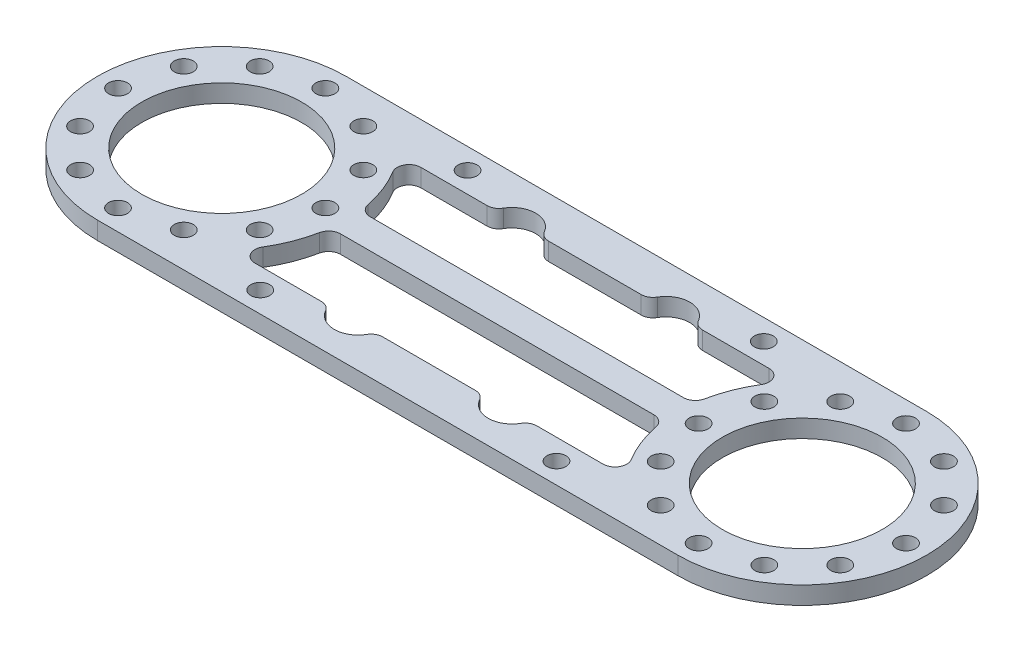
from build123d import *

# Parameters (mm, degrees)
SKETCH_1_R          = 13.5
SKETCH_1_R_2        = 1.6
EXTRUDE_1_DEPTH     = 3
CUT_EXTRUDE_START   = -10
CUT_EXTRUDE_1_DEPTH = 10
SKETCH_3_W          = 59.8
SKETCH_3_H          = 5
EXTRUDE_1_2_DEPTH   = 3
FILLET_1_R          = 2
SKETCH_4_R          = 1.6
CUT_EXTRUDE_2_DEPTH = 10


with BuildPart() as part:
    # 草图1 → Extrude 1 (new body)
    with BuildSketch(Plane(origin=(0, 0, 0), x_dir=(1, 0, 0), z_dir=(0, 1, 0))):
        with BuildLine():
            Line((-49, -44), (49, -44))
            ThreePointArc((49, -44), (70, -65), (49, -86))
            Line((49, -86), (-49, -86))
            ThreePointArc((-49, -86), (-70, -65), (-49, -44))
        make_face()
        with Locations(Location((-49, -65, 0), (0, 0, 270))):
            Circle(SKETCH_1_R, mode=Mode.SUBTRACT)
        with Locations(Location((49, -65, 0), (0, 0, 270))):
            Circle(SKETCH_1_R, mode=Mode.SUBTRACT)
        with Locations(Location((-49, -82.5, 0), (0, 0, 270))):
            Circle(SKETCH_1_R_2, mode=Mode.SUBTRACT)
        with Locations(Location((-57.75, -80.155444566, 0), (0, 0, 270))):
            Circle(SKETCH_1_R_2, mode=Mode.SUBTRACT)
        with Locations(Location((-64.155444566, -73.75, 0), (0, 0, 270))):
            Circle(SKETCH_1_R_2, mode=Mode.SUBTRACT)
        with Locations(Location((-66.5, -65, 0), (0, 0, 270))):
            Circle(SKETCH_1_R_2, mode=Mode.SUBTRACT)
        with Locations(Location((-64.155444566, -56.25, 0), (0, 0, 270))):
            Circle(SKETCH_1_R_2, mode=Mode.SUBTRACT)
        with Locations(Location((-57.75, -49.844555434, 0), (0, 0, 270))):
            Circle(SKETCH_1_R_2, mode=Mode.SUBTRACT)
        with Locations(Location((-49, -47.5, 0), (0, 0, 270))):
            Circle(SKETCH_1_R_2, mode=Mode.SUBTRACT)
        with Locations(Location((-40.25, -49.844555434, 0), (0, 0, 270))):
            Circle(SKETCH_1_R_2, mode=Mode.SUBTRACT)
        with Locations(Location((-33.844555434, -56.25, 0), (0, 0, 270))):
            Circle(SKETCH_1_R_2, mode=Mode.SUBTRACT)
        with Locations(Location((-31.5, -65, 0), (0, 0, 270))):
            Circle(SKETCH_1_R_2, mode=Mode.SUBTRACT)
        with Locations(Location((-33.844555434, -73.75, 0), (0, 0, 270))):
            Circle(SKETCH_1_R_2, mode=Mode.SUBTRACT)
        with Locations(Location((-40.25, -80.155444566, 0), (0, 0, 270))):
            Circle(SKETCH_1_R_2, mode=Mode.SUBTRACT)
        with Locations(Location((64.155444566, -56.25, 0), (0, 0, 270))):
            Circle(SKETCH_1_R_2, mode=Mode.SUBTRACT)
        with Locations(Location((66.5, -65, 0), (0, 0, 270))):
            Circle(SKETCH_1_R_2, mode=Mode.SUBTRACT)
        with Locations(Location((64.155444566, -73.75, 0), (0, 0, 270))):
            Circle(SKETCH_1_R_2, mode=Mode.SUBTRACT)
        with Locations(Location((57.75, -80.155444566, 0), (0, 0, 270))):
            Circle(SKETCH_1_R_2, mode=Mode.SUBTRACT)
        with Locations(Location((49, -82.5, 0), (0, 0, 270))):
            Circle(SKETCH_1_R_2, mode=Mode.SUBTRACT)
        with Locations(Location((40.25, -80.155444566, 0), (0, 0, 270))):
            Circle(SKETCH_1_R_2, mode=Mode.SUBTRACT)
        with Locations(Location((33.844555434, -73.75, 0), (0, 0, 270))):
            Circle(SKETCH_1_R_2, mode=Mode.SUBTRACT)
        with Locations(Location((31.5, -65, 0), (0, 0, 270))):
            Circle(SKETCH_1_R_2, mode=Mode.SUBTRACT)
        with Locations(Location((33.844555434, -56.25, 0), (0, 0, 270))):
            Circle(SKETCH_1_R_2, mode=Mode.SUBTRACT)
        with Locations(Location((40.25, -49.844555434, 0), (0, 0, 270))):
            Circle(SKETCH_1_R_2, mode=Mode.SUBTRACT)
        with Locations(Location((49, -47.5, 0), (0, 0, 270))):
            Circle(SKETCH_1_R_2, mode=Mode.SUBTRACT)
        with Locations(Location((57.75, -49.844555434, 0), (0, 0, 270))):
            Circle(SKETCH_1_R_2, mode=Mode.SUBTRACT)
        with Locations(Location((13, -52, 0), (0, 0, 270))):
            Circle(SKETCH_1_R_2, mode=Mode.SUBTRACT)
        with Locations(Location((-13, -52, 0), (0, 0, 270))):
            Circle(SKETCH_1_R_2, mode=Mode.SUBTRACT)
        with Locations(Location((13, -78, 0), (0, 0, 270))):
            Circle(SKETCH_1_R_2, mode=Mode.SUBTRACT)
        with Locations(Location((-13, -78, 0), (0, 0, 270))):
            Circle(SKETCH_1_R_2, mode=Mode.SUBTRACT)
    extrude(amount=EXTRUDE_1_DEPTH)

    # 草图2 → 切除-拉伸1 (cut)
    with BuildSketch(Plane(origin=(0, 3, 0), x_dir=(1, 0, 0), z_dir=(0, 1, 0)).offset(CUT_EXTRUDE_START)):
        with BuildLine():
            Line((-16.872983346, -51), (-33.347524158, -51))
            ThreePointArc((-33.347524158, -51), (-29.382380462, -57.506736115), (-28, -65))
            ThreePointArc((-28, -65), (-29.382380462, -72.493263885), (-33.347524158, -79))
            Line((-33.347524158, -79), (-16.872983346, -79))
            ThreePointArc((-16.872983346, -79), (-13.50401717, -74.031881215), (-9, -78))
            ThreePointArc((-9, -78), (-9.031881215, -78.50401717), (-9.127016654, -79))
            Line((-9.127016654, -79), (9.127016654, -79))
            ThreePointArc((9.127016654, -79), (12.49598283, -74.031881215), (17, -78))
            ThreePointArc((17, -78), (16.968118785, -78.50401717), (16.872983346, -79))
            Line((16.872983346, -79), (33.347524158, -79))
            ThreePointArc((33.347524158, -79), (28, -65), (33.347524158, -51))
            Line((33.347524158, -51), (16.872983346, -51))
            ThreePointArc((16.872983346, -51), (16.968118785, -51.49598283), (17, -52))
            ThreePointArc((17, -52), (12.49598283, -55.968118785), (9.127016654, -51))
            Line((9.127016654, -51), (-9.127016654, -51))
            ThreePointArc((-9.127016654, -51), (-9.031881215, -51.49598283), (-9, -52))
            ThreePointArc((-9, -52), (-13.50401717, -55.968118785), (-16.872983346, -51))
        make_face()
        with BuildLine():
            ThreePointArc((17, -78), (12.49598283, -74.031881215), (9.127016654, -79))
            Line((9.127016654, -79), (11.7510004, -79))
            ThreePointArc((11.7510004, -79), (12.470094046, -76.490298149), (14.6, -78))
            ThreePointArc((14.6, -78), (14.509701851, -78.529905954), (14.2489996, -79))
            Line((14.2489996, -79), (16.872983346, -79))
            ThreePointArc((16.872983346, -79), (16.968118785, -78.50401717), (17, -78))
        make_face()
        with BuildLine():
            Line((11.7510004, -79), (9.127016654, -79))
            ThreePointArc((9.127016654, -79), (13, -82), (16.872983346, -79))
            Line((16.872983346, -79), (14.2489996, -79))
            ThreePointArc((14.2489996, -79), (13, -79.6), (11.7510004, -79))
        make_face()
        with BuildLine():
            ThreePointArc((-9.127016654, -51), (-13, -48), (-16.872983346, -51))
            Line((-16.872983346, -51), (-14.2489996, -51))
            ThreePointArc((-14.2489996, -51), (-13, -50.4), (-11.7510004, -51))
            Line((-11.7510004, -51), (-9.127016654, -51))
        make_face()
        with BuildLine():
            Line((-14.2489996, -51), (-16.872983346, -51))
            ThreePointArc((-16.872983346, -51), (-13.50401717, -55.968118785), (-9, -52))
            ThreePointArc((-9, -52), (-9.031881215, -51.49598283), (-9.127016654, -51))
            Line((-9.127016654, -51), (-11.7510004, -51))
            ThreePointArc((-11.7510004, -51), (-11.490298149, -51.470094046), (-11.4, -52))
            ThreePointArc((-11.4, -52), (-13.529905954, -53.509701851), (-14.2489996, -51))
        make_face()
        with BuildLine():
            ThreePointArc((16.872983346, -51), (13, -48), (9.127016654, -51))
            Line((9.127016654, -51), (11.7510004, -51))
            ThreePointArc((11.7510004, -51), (13, -50.4), (14.2489996, -51))
            Line((14.2489996, -51), (16.872983346, -51))
        make_face()
        with BuildLine():
            Line((11.7510004, -51), (9.127016654, -51))
            ThreePointArc((9.127016654, -51), (12.49598283, -55.968118785), (17, -52))
            ThreePointArc((17, -52), (16.968118785, -51.49598283), (16.872983346, -51))
            Line((16.872983346, -51), (14.2489996, -51))
            ThreePointArc((14.2489996, -51), (14.509701851, -51.470094046), (14.6, -52))
            ThreePointArc((14.6, -52), (12.470094046, -53.509701851), (11.7510004, -51))
        make_face()
        with BuildLine():
            ThreePointArc((-9, -78), (-13.50401717, -74.031881215), (-16.872983346, -79))
            Line((-16.872983346, -79), (-14.2489996, -79))
            ThreePointArc((-14.2489996, -79), (-13.529905954, -76.490298149), (-11.4, -78))
            ThreePointArc((-11.4, -78), (-11.490298149, -78.529905954), (-11.7510004, -79))
            Line((-11.7510004, -79), (-9.127016654, -79))
            ThreePointArc((-9.127016654, -79), (-9.031881215, -78.50401717), (-9, -78))
        make_face()
        with BuildLine():
            Line((-14.2489996, -79), (-16.872983346, -79))
            ThreePointArc((-16.872983346, -79), (-13, -82), (-9.127016654, -79))
            Line((-9.127016654, -79), (-11.7510004, -79))
            ThreePointArc((-11.7510004, -79), (-13, -79.6), (-14.2489996, -79))
        make_face()
    extrude(amount=CUT_EXTRUDE_1_DEPTH, mode=Mode.SUBTRACT)

    # 草图3 → Extrude 1 2 (add)
    with BuildSketch(Plane(origin=(0, 3, 0), x_dir=(1, 0, 0), z_dir=(0, 1, 0))):
        with Locations((0, -65)):
            Rectangle(SKETCH_3_W, SKETCH_3_H)
    extrude(amount=-EXTRUDE_1_2_DEPTH)

    # 圆角1
    fillet_1_edges = [part.edges().sort_by_distance(p)[0] for p in [
        (-33.347524158, 1.5, 79),
        (-33.347524158, 1.5, 51),
        (-16.872983346, 1.5, 51),
        (-9.127016654, 1.5, 51),
        (9.127016654, 1.5, 51),
        (16.872983346, 1.5, 51),
        (33.347524158, 1.5, 51),
        (33.347524158, 1.5, 79),
        (16.872983346, 1.5, 79),
        (9.127016654, 1.5, 79),
        (-16.872983346, 1.5, 79),
        (-9.127016654, 1.5, 79),
        (28.149340538, 1.5, 62.5),
        (28.149340538, 1.5, 67.5),
        (-28.149340538, 1.5, 62.5),
        (-28.149340538, 1.5, 67.5),
    ]]
    fillet(fillet_1_edges, radius=FILLET_1_R)

    # 草图4 → 切除-拉伸2 (cut)
    with BuildSketch(Plane(origin=(0, 3, 0), x_dir=(1, 0, 0), z_dir=(0, 1, 0)).offset(CUT_EXTRUDE_START)):
        with Locations(Location((-49, -82.5, 0), (0, 0, 270))):
            Circle(SKETCH_4_R)
        with Locations(Location((-49, -47.5, 0), (0, 0, 270))):
            Circle(SKETCH_4_R)
        with Locations(Location((25, -82.5, 0), (0, 0, 270))):
            Circle(SKETCH_4_R)
        with Locations(Location((-25, -82.5, 0), (0, 0, 270))):
            Circle(SKETCH_4_R)
        with Locations(Location((-25, -47.5, 0), (0, 0, 270))):
            Circle(SKETCH_4_R)
        with Locations(Location((25, -47.5, 0), (0, 0, 270))):
            Circle(SKETCH_4_R)
    extrude(amount=CUT_EXTRUDE_2_DEPTH, mode=Mode.SUBTRACT)


solid = part.part
